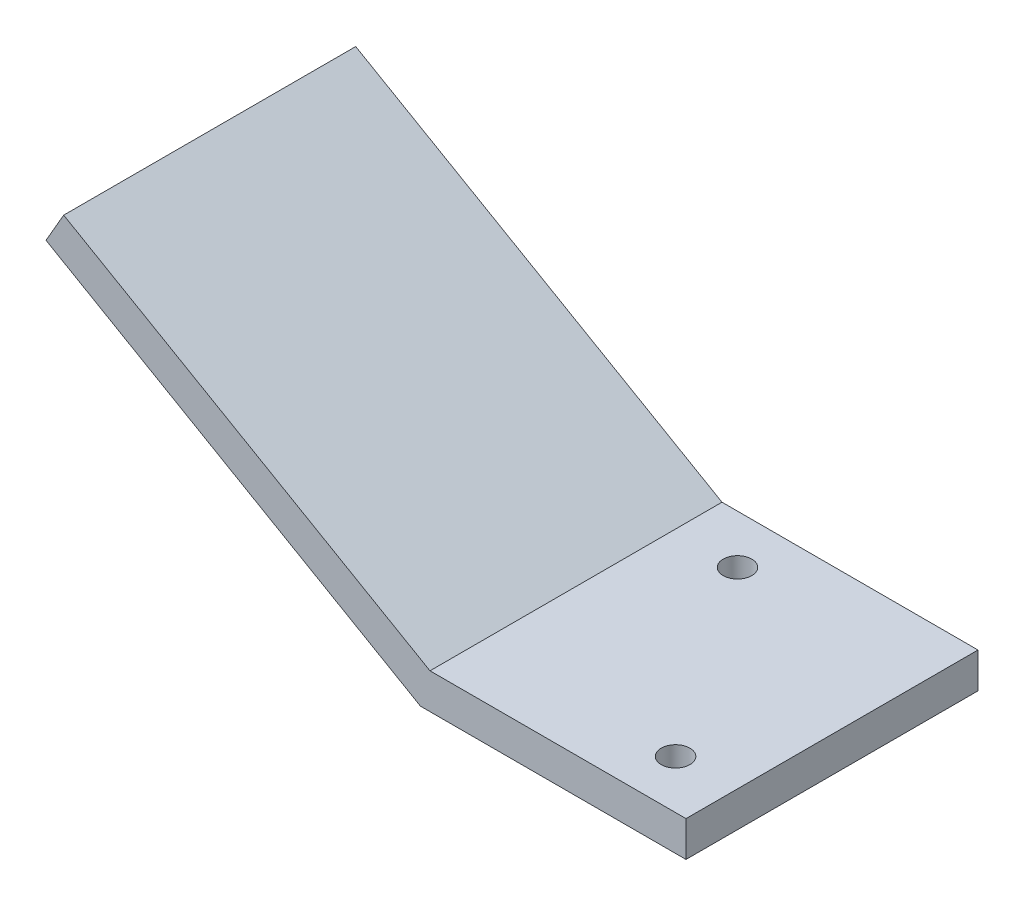
from build123d import *

# Parameters (mm, degrees)
SKETCH1_W           = 50
SKETCH1_H           = 23
BOSS_EXTRUDE1_DEPTH = 20
CUT_EXTRUDE3_DEPTH  = 30
CUT_EXTRUDE4_DEPTH  = 30
SKETCH9_W           = 23
SKETCH9_H           = 4
BOSS_EXTRUDE2_DEPTH = 20
BOSS_EXTRUDE3_DEPTH = 10
SKETCH22_W          = 33
SKETCH22_H          = 4
BOSS_EXTRUDE4_DEPTH = 5
CUT_EXTRUDE7_DEPTH  = 5
SKETCH26_W          = 30
SKETCH26_H          = 10
BOSS_EXTRUDE5_DEPTH = 10
SKETCH28_W          = 30
SKETCH28_H          = 18
BOSS_EXTRUDE6_DEPTH = 4


with BuildPart() as part:
    # Sketch1 → Boss-Extrude1 (new body)
    with BuildSketch(Plane(origin=(0, 0, 0), x_dir=(1, 0, 0), z_dir=(0, 1, 0))):
        Rectangle(SKETCH1_W, SKETCH1_H)
    extrude(amount=BOSS_EXTRUDE1_DEPTH)

    # Sketch2 → Cut-Extrude3 (cut)
    with BuildSketch(Plane.XY.offset(11.5)):
        Polygon((0, 0), (-25, 14.43375673), (-25, 0), align=None)
        Polygon((1.07179677, 4), (25, 4), (25, 20), (-25, 20), (-25, 19.052558883), align=None)
    extrude(amount=-CUT_EXTRUDE3_DEPTH, mode=Mode.SUBTRACT)

    # Sketch4 → Cut-Extrude4 (cut)
    with BuildSketch(Plane.XY.offset(11.5)):
        Polygon((-25, 14.43375673), (-23, 17.897858345), (-25, 19.052558883), align=None)
    extrude(amount=-CUT_EXTRUDE4_DEPTH, mode=Mode.SUBTRACT)

    # Sketch9 → Boss-Extrude2 (add)
    with BuildSketch(Plane(origin=(-25, 14.43375673, 0), x_dir=(0, 0, 1), z_dir=(-0.8660254037844407, 0.4999999999999965, 0))):
        with Locations((0, 2)):
            Rectangle(SKETCH9_W, SKETCH9_H)
    extrude(amount=BOSS_EXTRUDE2_DEPTH)

    # Sketch11 → Boss-Extrude3 (add)
    with BuildSketch(Plane(origin=(0, 0, -11.5), x_dir=(-1, 0, 0), z_dir=(0, 0, -1))):
        Polygon((-25, 4), (-1.07179677, 4), (40.320508076, 27.897858345), (42.320508076, 24.43375673), (0, 0), (-25, 0), align=None)
    extrude(amount=BOSS_EXTRUDE3_DEPTH)

    # Sketch22 → Boss-Extrude4 (add)
    with BuildSketch(Plane(origin=(25, 0, 0), x_dir=(0, 0, -1), z_dir=(1, 0, 0))):
        with Locations((5, 2)):
            Rectangle(SKETCH22_W, SKETCH22_H)
    extrude(amount=BOSS_EXTRUDE4_DEPTH)

    # Sketch23 → Cut-Extrude7 (cut)
    with BuildSketch(Plane.XZ):
        with BuildLine():
            ThreePointArc((23.322235494, 7.62), (22.176722509, 4.854487014), (24.942235494, 6))
            Line((24.942235494, 6), (23.322235494, 6))
            Line((23.322235494, 6), (23.322235494, 7.62))
        make_face()
        with BuildLine():
            Line((23.322235494, 6), (24.942235494, 6))
            ThreePointArc((24.942235494, 6), (24.46774848, 7.145512986), (23.322235494, 7.62))
            Line((23.322235494, 7.62), (23.322235494, 6))
        make_face()
        with BuildLine():
            ThreePointArc((6.702235494, -16), (7.176722509, -17.145512986), (8.322235494, -17.62))
            Line((8.322235494, -17.62), (8.322235494, -16))
            Line((8.322235494, -16), (6.702235494, -16))
        make_face()
        with BuildLine():
            Line((8.322235494, -16), (8.322235494, -17.62))
            ThreePointArc((8.322235494, -17.62), (9.46774848, -17.145512986), (9.942235494, -16))
            ThreePointArc((9.942235494, -16), (8.322235494, -14.38), (6.702235494, -16))
            Line((6.702235494, -16), (8.322235494, -16))
        make_face()
    extrude(amount=-CUT_EXTRUDE7_DEPTH, mode=Mode.SUBTRACT)

    # Sketch26 → Boss-Extrude5 (add)
    with BuildSketch(Plane(origin=(0, 0, 0), x_dir=(0.8660254037844417, -0.4999999999999946, 0), z_dir=(-0.4999999999999946, -0.8660254037844417, 0))):
        with Locations((-25, -5)):
            Rectangle(SKETCH26_W, SKETCH26_H)
    extrude(amount=BOSS_EXTRUDE5_DEPTH)

    # Sketch28 → Boss-Extrude6 (add)
    with BuildSketch(Plane(origin=(-5, -8.660254038, 0), x_dir=(0.8660254037844417, -0.4999999999999946, 0), z_dir=(-0.4999999999999946, -0.8660254037844417, 0))):
        with Locations((-25, -5)):
            Rectangle(SKETCH28_W, SKETCH28_H)
    extrude(amount=-BOSS_EXTRUDE6_DEPTH)


solid = part.part
